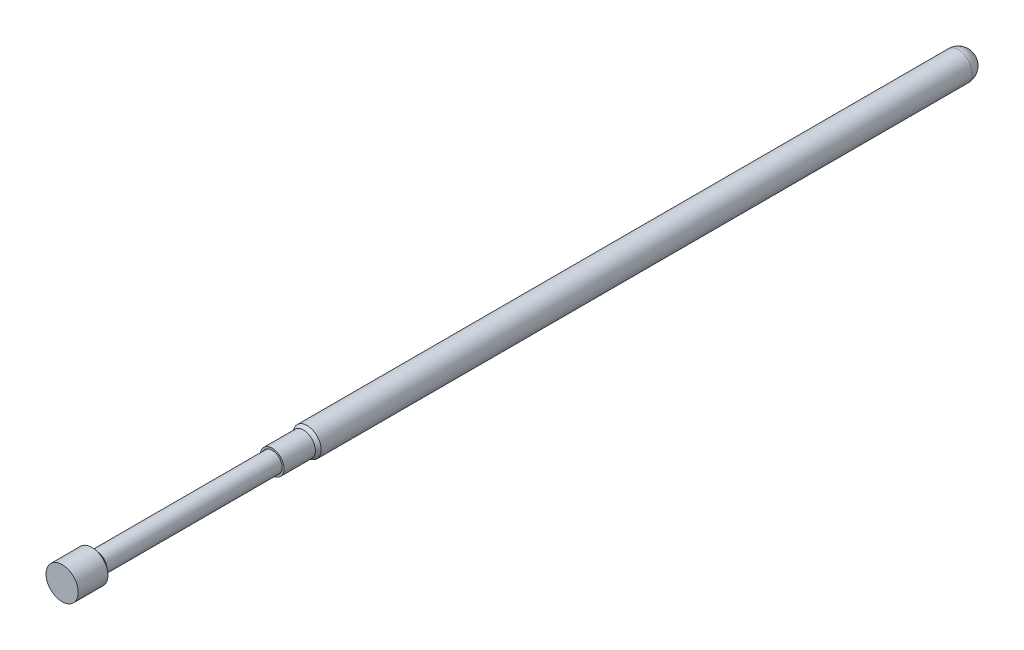
from build123d import *

# Parameters (mm, degrees)
SKETCH4_R          = 0.36576
CUT_EXTRUDE1_DEPTH = 13.335


with BuildPart() as part:
    # Sketch2 → Revolve1 (revolve)
    with BuildSketch(Plane(origin=(0, 0, 0), x_dir=(0, 0, -1), z_dir=(1, 0, 0))):
        with BuildLine():
            Line((-7.62, 0.508), (16.002, 0.508))
            ThreePointArc((16.002, 0.508), (16.361210245, 0.359210245), (16.51, 0))
            Line((16.51, 0), (-8.89, 0))
            Line((-8.89, 0), (-8.89, 0.4318))
            Line((-8.89, 0.4318), (-7.751982272, 0.4318))
            Line((-7.751982272, 0.4318), (-7.62, 0.508))
        make_face()
    revolve(axis=Axis((0, 0, -16.51), (0, 0, 1)))

    # Sketch4 → Cut-Extrude1 (cut)
    with BuildSketch(Plane.XY.offset(8.89)):
        Circle(SKETCH4_R)
    extrude(amount=-CUT_EXTRUDE1_DEPTH, mode=Mode.SUBTRACT)


with BuildPart() as body_2:
    # Sketch3 → Revolve2 (revolve)
    with BuildSketch(Plane(origin=(0, 0, 0), x_dir=(0, 0, -1), z_dir=(1, 0, 0))):
        Polygon((-16.51, 0.5842), (-16.51, 0), (-2.54, 0), (-2.54, 0.3556), (-15.24, 0.3556), (-15.4305, 0.5842), align=None)
    revolve(axis=Axis((0, 0, 0), (0, 0, 1)))


solid = Compound([part.part, body_2.part])
